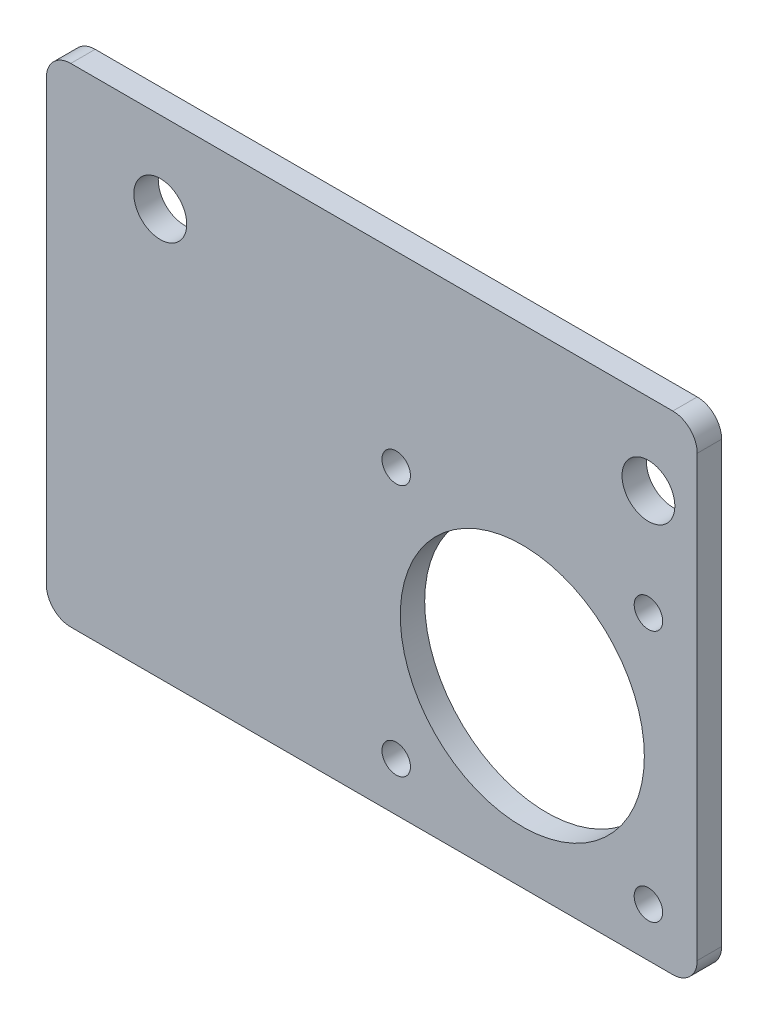
from build123d import *

# Parameters (mm, degrees)
SKIZZE1_W                       = 80
SKIZZE1_H                       = 60
AUFSATZ_LINEAR_AUSTRAGEN1_DEPTH = 3
VERRUNDUNG1_R                   = 3
SKIZZE2_R                       = 1.75
SKIZZE2_R_2                     = 3.25
SKIZZE2_R_3                     = 15
SCHNITT_LINEAR_AUSTRAGEN1_DEPTH = 12


with BuildPart() as part:
    # Skizze1 → Aufsatz-Linear austragen1 (new body)
    with BuildSketch(Plane.XY):
        Rectangle(SKIZZE1_W, SKIZZE1_H)
    extrude(amount=AUFSATZ_LINEAR_AUSTRAGEN1_DEPTH)

    # Verrundung1
    verrundung1_edges = [part.edges().sort_by_distance(p)[0] for p in [
        (-40, 30, 1.5),
        (40, 30, 1.5),
        (40, -30, 1.5),
        (-40, -30, 1.5),
    ]]
    fillet(verrundung1_edges, radius=VERRUNDUNG1_R)

    # Skizze2 → Schnitt-Linear austragen1 (cut)
    with BuildSketch(Plane.XY.offset(3)):
        with Locations((3, -24)):
            Circle(SKIZZE2_R)
        with Locations((3, 7)):
            Circle(SKIZZE2_R)
        with Locations((34, 7)):
            Circle(SKIZZE2_R)
        with Locations((34, -24)):
            Circle(SKIZZE2_R)
        with Locations((34, 20)):
            Circle(SKIZZE2_R_2)
        with Locations((-26, 20)):
            Circle(SKIZZE2_R_2)
        with Locations((18.5, -8.5)):
            Circle(SKIZZE2_R_3)
    extrude(amount=-SCHNITT_LINEAR_AUSTRAGEN1_DEPTH, mode=Mode.SUBTRACT)


solid = part.part
